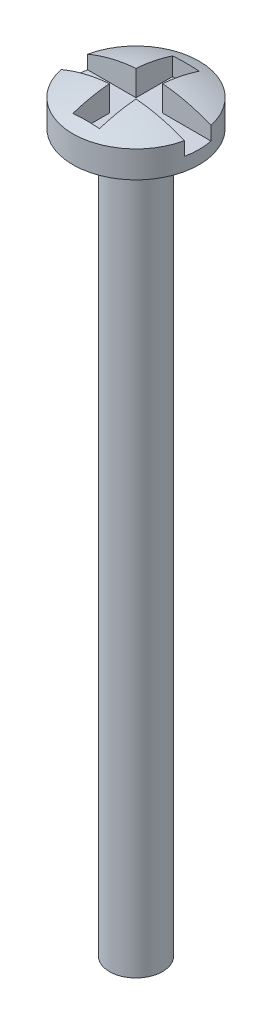
from build123d import *

# Parameters (mm, degrees)
SKETCH_1_R          = 1
EXTRUDE_1_DEPTH     = 27
SKETCH_2_R          = 2.375
EXTRUDE_2_DEPTH     = 1.5
SKETCH_3_W          = 7.004697232
SKETCH_3_H          = 1
CUT_EXTRUDE_1_DEPTH = 1
SKETCH_4_W          = 1
SKETCH_4_H          = 3.75
CUT_EXTRUDE_2_DEPTH = 1


with BuildPart() as part:
    # 草图1 → 拉伸1 (new body)
    with BuildSketch(Plane(origin=(0, 0, 0), x_dir=(1, 0, 0), z_dir=(0, 1, 0))):
        with Locations(Location((0, 0, 0), (0, 0, 270))):
            Circle(SKETCH_1_R)
    extrude(amount=EXTRUDE_1_DEPTH)

    # 草图2 → 拉伸2 (add)
    with BuildSketch(Plane(origin=(0, 27, 0), x_dir=(-1, 0, 0), z_dir=(0, 1, 0))):
        with Locations(Location((0, 0, 0), (0, 0, 90))):
            Circle(SKETCH_2_R)
    extrude(amount=EXTRUDE_2_DEPTH)

    # 草图3 → 切除-拉伸1 (cut)
    with BuildSketch(Plane(origin=(0, 28.5, 0), x_dir=(-1, 0, 0), z_dir=(0, 1, 0))):
        Rectangle(SKETCH_3_W, SKETCH_3_H)
    extrude(amount=-CUT_EXTRUDE_1_DEPTH, mode=Mode.SUBTRACT)

    # 草图4 → 切除-拉伸2 (cut)
    with BuildSketch(Plane(origin=(0, 28.5, 0), x_dir=(-1, 0, 0), z_dir=(0, 1, 0))):
        Rectangle(SKETCH_4_W, SKETCH_4_H)
    extrude(amount=-CUT_EXTRUDE_2_DEPTH, mode=Mode.SUBTRACT)

    # 草图5 → 切除-旋转16 (revolve, cut)
    with BuildSketch(Plane(origin=(0, 0, 0), x_dir=(0, 0, -1), z_dir=(1, 0, 0)), mode=Mode.PRIVATE) as cut_revolve_16_sk:
        with BuildLine():
            Line((0, 31.949208276), (-3.49520534, 31.949208276))
            Line((-3.49520534, 31.949208276), (-3.49520534, 27.376837052))
            ThreePointArc((-3.49520534, 27.376837052), (-1.835616748, 28.212312242), (0, 28.5))
            Line((0, 28.5), (0, 31.949208276))
        make_face()
    revolve(cut_revolve_16_sk.sketch.rotate(Axis((0, -2.105917543, 0), (0, 1, 0)), 257.846802531), axis=Axis((0, -2.105917543, 0), (0, 1, 0)), mode=Mode.SUBTRACT)


solid = part.part
